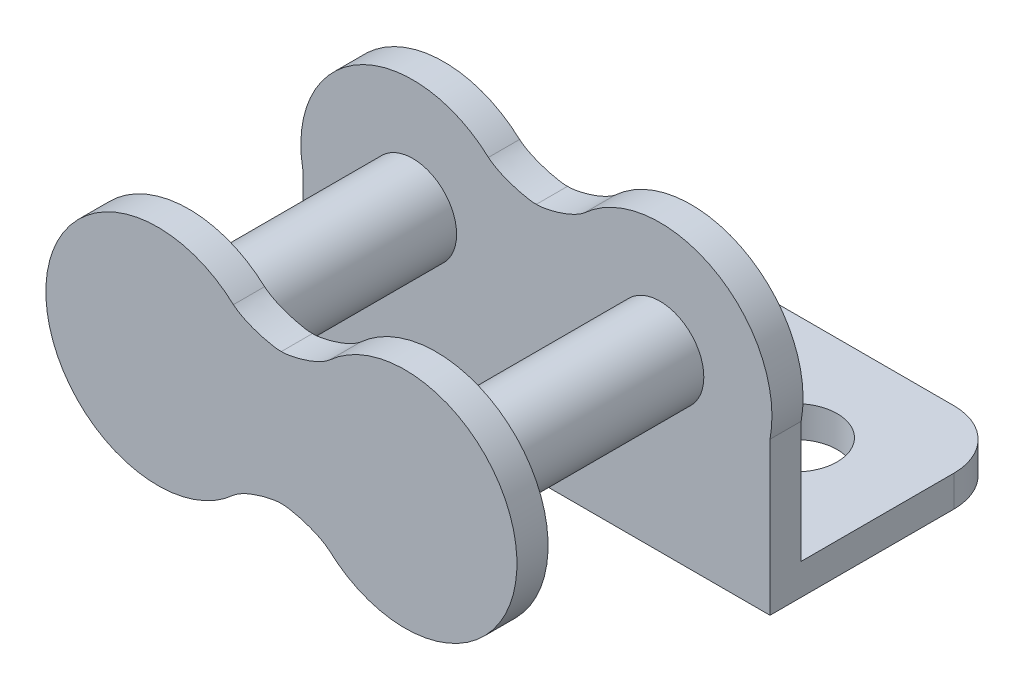
from build123d import *

# Parameters (mm, degrees)
SKETCH_1_R          = 4.25
SKETCH_1_R_2        = 2.25
EXTRUDE_1_DEPTH     = 4.45
EXTRUDE_1_2_DEPTH   = 4.45
SKETCH_2_R          = 5.75
SKETCH_2_R_2        = 4.25
SKETCH_2_R_3        = 2.25
EXTRUDE_3_DEPTH     = 1.6
SKETCH_3_R          = 4.25
CUT_EXTRUDE_1_DEPTH = 4.45
EXTRUDE_START       = -13.1
SKETCH_4_R          = 2.25
EXTRUDE_4_DEPTH     = 13.1
EXTRUDE_START_2     = 1.6
SKETCH_5_W          = 24
SKETCH_5_H          = 7.832292175
EXTRUDE_6_DEPTH     = 1.6
SKETCH_6_W          = 24
SKETCH_6_H          = 1.6
EXTRUDE_7_DEPTH     = 10.85
SKETCH_9_R          = 2.15
CUT_EXTRUDE_2_DEPTH = 28.22650373
FILLET_1_R          = 3


with BuildPart() as part:
    # 草图1 → 凸台-拉伸1 (new body)
    with BuildSketch(Plane.XY):
        with Locations((-6.35, 0)):
            Circle(SKETCH_1_R)
        with Locations((-6.35, 0)):
            Circle(SKETCH_1_R_2, mode=Mode.SUBTRACT)
    extrude(amount=EXTRUDE_1_DEPTH)



with BuildPart() as body_2:
    # 草图1 → Extrude 1 2 (new body)
    with BuildSketch(Plane.XY):
        with Locations(Location((6.35, 0, 0), (0, 0, 180))):
            Circle(SKETCH_1_R)
        with Locations(Location((6.35, 0, 0), (0, 0, 180))):
            Circle(SKETCH_1_R_2, mode=Mode.SUBTRACT)
    extrude(amount=EXTRUDE_1_2_DEPTH)


with BuildPart() as part_1:
    add(part.part)

    add(body_2.part)  # 凸台-拉伸3 merges body 2
    # 草图2 → 凸台-拉伸3 (add)
    # profile 1 of 4: a face of its own
    with BuildSketch(Plane.XY.offset(4.45)):
        with Locations((-6.35, 0)):
            Circle(SKETCH_2_R)
        with Locations((-6.35, 0)):
            Circle(SKETCH_2_R_2, mode=Mode.SUBTRACT)
    # profile 2 of 4: a face of its own
    with BuildSketch(Plane.XY.offset(4.45)):
        with Locations((-6.35, 0)):
            Circle(SKETCH_2_R_2)
        with Locations((-6.35, 0)):
            Circle(SKETCH_2_R_3, mode=Mode.SUBTRACT)
    # profile 3 of 4: a face of its own
    with BuildSketch(Plane.XY.offset(4.45)):
        with BuildLine():
            ThreePointArc((-2.464522189, 4.238580208), (-1.086731177, 2.315275641), (-0.6, 0))
            ThreePointArc((-0.6, 0), (-1.086731177, -2.315275641), (-2.464522189, -4.238580208))
            add(Edge.make_bspline(
                [(-2.464522189, -4.238580208), (-1.801147303, -3.67793909), (-0.370790644, -3.34588107), (0, -3.386350938)],
                knots=[0, 0, 0, 0, 1, 1, 1, 1], degree=3))
            add(Edge.make_bspline(
                [(2.464522189, -4.238580208), (1.801147303, -3.67793909), (0.370790644, -3.34588107), (0, -3.386350938)],
                knots=[0, 0, 0, 0, 1, 1, 1, 1], degree=3))
            ThreePointArc((2.464522189, -4.238580208), (0.6, 0), (2.464522189, 4.238580208))
            add(Edge.make_bspline(
                [(2.464522189, 4.238580208), (1.801147303, 3.67793909), (0.370790644, 3.34588107), (0, 3.386350938)],
                knots=[0, 0, 0, 0, 1, 1, 1, 1], degree=3))
            add(Edge.make_bspline(
                [(-2.464522189, 4.238580208), (-1.801147303, 3.67793909), (-0.370790644, 3.34588107), (0, 3.386350938)],
                knots=[0, 0, 0, 0, 1, 1, 1, 1], degree=3))
        make_face()
    # profile 4 of 4: a face of its own
    with BuildSketch(Plane.XY.offset(4.45)):
        with Locations((6.35, 0)):
            Circle(SKETCH_2_R)
        with Locations(Location((6.35, 0, 0), (0, 0, 180))):
            Circle(SKETCH_2_R_3, mode=Mode.SUBTRACT)
    extrude(amount=EXTRUDE_3_DEPTH)

    # 草图3 → 切除-拉伸1 (cut)
    with BuildSketch(Plane(origin=(0, 0, 0), x_dir=(-1, 0, 0), z_dir=(0, 0, -1))):
        with Locations((6.35, 0)):
            Circle(SKETCH_3_R)
        with Locations((-6.35, 0)):
            Circle(SKETCH_3_R)
    extrude(amount=-CUT_EXTRUDE_1_DEPTH, mode=Mode.SUBTRACT)

    # 草图4 → 凸台-拉伸4 (add)
    with BuildSketch(Plane.XY.offset(6.05).offset(EXTRUDE_START)):
        with Locations((-6.35, 0)):
            Circle(SKETCH_4_R)
        with Locations((6.35, 0)):
            Circle(SKETCH_4_R)
    extrude(amount=EXTRUDE_4_DEPTH)

    # 草图5 → 凸台-拉伸6 (add)
    with BuildSketch(Plane(origin=(0, 0, -7.05), x_dir=(-1, 0, 0), z_dir=(0, 0, -1)).offset(EXTRUDE_START_2)):
        with Locations((0, -4.983853912)):
            Rectangle(SKETCH_5_W, SKETCH_5_H)
        with BuildLine():
            ThreePointArc((2.464522189, -4.238580208), (12.1, 0), (2.464522189, 4.238580208))
            add(Edge.make_bspline(
                [(2.464522189, 4.238580208), (1.801147303, 3.67793909), (0.370790644, 3.34588107), (0, 3.386350938)],
                knots=[0, 0, 0, 0, 1, 1, 1, 1], degree=3))
            add(Edge.make_bspline(
                [(0, 3.386350938), (-0.370790644, 3.34588107), (-1.801147303, 3.67793909), (-2.464522189, 4.238580208)],
                knots=[0, 0, 0, 0, 1, 1, 1, 1], degree=3))
            ThreePointArc((-2.464522189, 4.238580208), (-12.1, 0), (-2.464522189, -4.238580208))
            add(Edge.make_bspline(
                [(-2.464522189, -4.238580208), (-1.801147303, -3.67793909), (-0.370790644, -3.34588107), (0, -3.386350938)],
                knots=[0, 0, 0, 0, 1, 1, 1, 1], degree=3))
            add(Edge.make_bspline(
                [(0, -3.386350938), (0.370790644, -3.34588107), (1.801147303, -3.67793909), (2.464522189, -4.238580208)],
                knots=[0, 0, 0, 0, 1, 1, 1, 1], degree=3))
        make_face()
    extrude(amount=-EXTRUDE_6_DEPTH)

    # 草图6 → 凸台-拉伸7 (add)
    with BuildSketch(Plane(origin=(0, 0, -8.65), x_dir=(-1, 0, 0), z_dir=(0, 0, -1))):
        with Locations((0, -8.1)):
            Rectangle(SKETCH_6_W, SKETCH_6_H)
    extrude(amount=EXTRUDE_7_DEPTH)

    # 草图9 → 切除-拉伸2 (cut, through all)
    with BuildSketch(Plane.XZ.offset(8.9)):
        with Locations(Location((-6.35, -14, 0), (0, 0, 270))):
            Circle(SKETCH_9_R)
        with Locations((6.35, -14)):
            Circle(SKETCH_9_R)
    extrude(amount=-CUT_EXTRUDE_2_DEPTH, mode=Mode.SUBTRACT)

    # 圆角1
    fillet_1_edges = [part_1.edges().sort_by_distance(p)[0] for p in [
        (-12, -8.1, -19.5),
        (12, -8.1, -19.5),
    ]]
    fillet(fillet_1_edges, radius=FILLET_1_R)


solid = part_1.part
